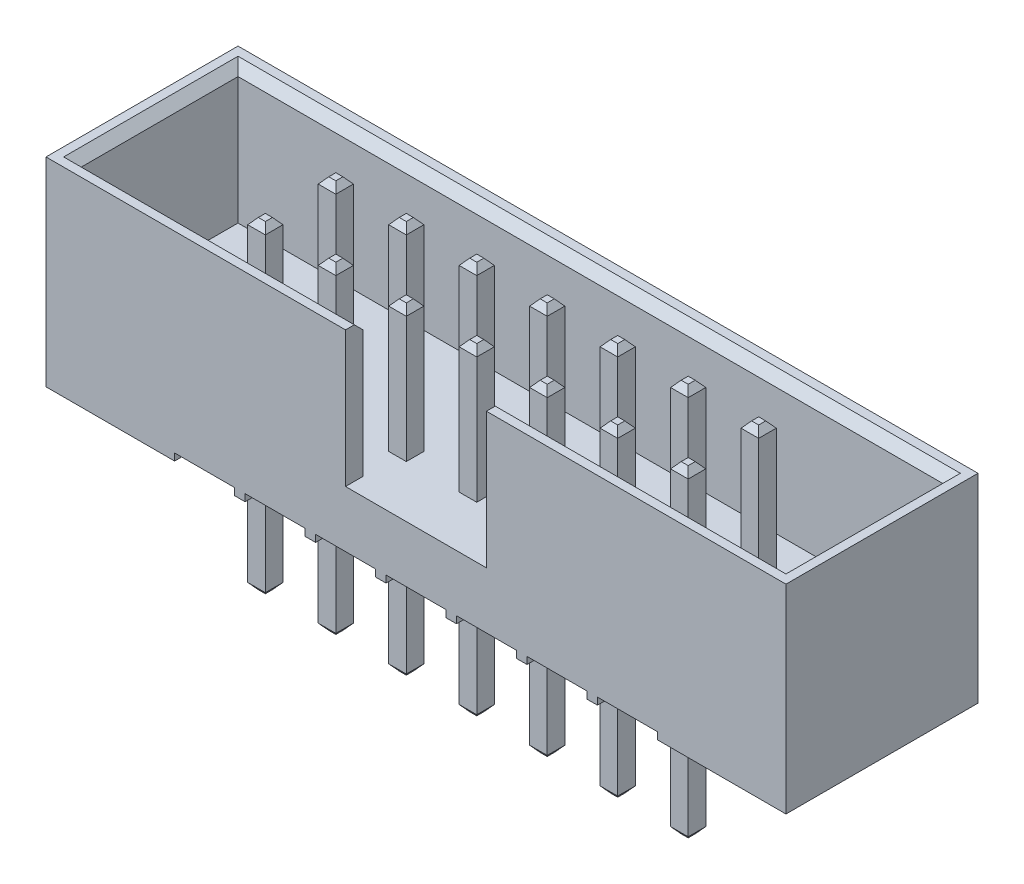
from build123d import *
from OCP.BRepFilletAPI import BRepFilletAPI_MakeChamfer

# Parameters (mm, degrees)
SKETCH_1_W                             = 21
SKETCH_1_H                             = 5.45
EXTRUDE_5083_DEPTH                     = 5.65
SKETCH_6_W                             = 1.7
SKETCH_6_H                             = 0.2
CUT_EXTRUDE_7_DEPTH                    = 23.419299721
PATTERN_LINEAR_3_COUNT                 = 7
PATTERN_LINEAR_3_PITCH                 = 2
SKETCH_2_W                             = 20
SKETCH_2_H                             = 4.45
CUT_EXTRUDE_2_DEPTH                    = 3.85
CUT_EXTRUDE_3_REACH                    = 24.419
SKETCH_3_W                             = 4
SKETCH_3_H                             = 3.85
SKETCH_5_W                             = 0.5
SKETCH_5_H                             = 0.5
EXTRUDE_6751_DEPTH                     = 9.15
CHAMFER_6834_SIZE                      = 0.25
CHAMFER_7155_SIZE                      = 0.15
CHAMFER_7155_SIZE2                     = 0.178763039
PATTERN_LINEAR_2_COUNT                 = 7
PATTERN_LINEAR_2_PITCH                 = 2
CHAMFER_7155_OF_PATTERN_LINEAR_2_SIZE  = 0.15
CHAMFER_7155_OF_PATTERN_LINEAR_2_SIZE2 = 0.178763039


with BuildPart() as part:
    # Эскиз1 → Extrude 5083 (new body)
    with BuildSketch(Plane(origin=(0, 0, 0), x_dir=(1, 0, 0), z_dir=(0, 1, 0))):
        with Locations((10.5, 2.725)):
            Rectangle(SKETCH_1_W, SKETCH_1_H)
    extrude(amount=EXTRUDE_5083_DEPTH)

    # Эскиз6 → Вырез-Вытянуть7 (cut, through all)
    with BuildSketch(Plane.XY):
        with Locations((4.5, 0.1)):
            Rectangle(SKETCH_6_W, SKETCH_6_H)
    cut_extrude_7 = extrude(amount=-CUT_EXTRUDE_7_DEPTH, mode=Mode.SUBTRACT)

    # Линейный массив3: Вырез-Вытянуть7 ×7
    with Locations(*[(i * PATTERN_LINEAR_3_PITCH, 0, 0) for i in range(1, PATTERN_LINEAR_3_COUNT)]):
        add(cut_extrude_7, mode=Mode.SUBTRACT)

    # Эскиз2 → Вырез-Вытянуть2 (cut)
    with BuildSketch(Plane(origin=(0, 5.65, 0), x_dir=(1, 0, 0), z_dir=(0, 1, 0))):
        with Locations((10.5, 2.725)):
            Rectangle(SKETCH_2_W, SKETCH_2_H)
    extrude(amount=-CUT_EXTRUDE_2_DEPTH, mode=Mode.SUBTRACT)

    # Эскиз3 → Вырез-Вытянуть3 (cut, up to next)
    with BuildSketch(Plane.XY, mode=Mode.PRIVATE) as cut_extrude_3_sk1:
        with Locations((10.5, 3.725)):
            Rectangle(SKETCH_3_W, SKETCH_3_H)
    cut_extrude_3_tool1 = extrude(cut_extrude_3_sk1.sketch, amount=-CUT_EXTRUDE_3_REACH, mode=Mode.PRIVATE) & part.part
    add(cut_extrude_3_tool1.solids().sort_by_distance((10.5, 3.725, 0))[0], mode=Mode.SUBTRACT)

    # Эскиз5 → Extrude 6751 (add)
    with BuildSketch(Plane(origin=(0, -3.6, 0), x_dir=(1, 0, 0), z_dir=(0, 1, 0))):
        with Locations((4.5, 1.725)):
            Rectangle(SKETCH_5_W, SKETCH_5_H)
        with Locations((4.5, 3.725)):
            Rectangle(SKETCH_5_W, SKETCH_5_H)
    extrude_6751 = extrude(amount=EXTRUDE_6751_DEPTH)

    # Chamfer 6834
    chamfer_6834_edges = [part.edges().sort_by_distance(p)[0] for p in [
        (0.5, 5.65, -2.725),
        (4.5, 5.65, -0.5),
        (20.5, 5.65, -2.725),
        (10.5, 5.65, -4.95),
        (16.5, 5.65, -0.5),
    ]]
    chamfer(chamfer_6834_edges, length=CHAMFER_6834_SIZE)

    # Chamfer 7155: one chamfer whose edges measure the first distance from different faces: ONE call of the kernel's chamfer builder (chamfer() names one face for all edges)
    chamfer_7155_edges_1 = [part.edges().sort_by_distance(p)[0] for p in [
        (4.5, -3.6, -1.475),
        (4.25, -3.6, -1.725),
        (4.5, -3.6, -1.975),
        (4.75, -3.6, -1.725),
    ]]
    chamfer_7155_side_1 = [part.faces().sort_by_distance(p)[0] for p in [
        (4.5, -3.6, -1.725),
    ]]
    chamfer_7155_edges_2 = [part.edges().sort_by_distance(p)[0] for p in [
        (4.5, 5.55, -1.475),
        (4.25, 5.55, -1.725),
        (4.5, 5.55, -1.975),
        (4.75, 5.55, -1.725),
    ]]
    chamfer_7155_side_2 = [part.faces().sort_by_distance(p)[0] for p in [
        (4.5, 5.55, -1.725),
    ]]
    chamfer_7155_edges_3 = [part.edges().sort_by_distance(p)[0] for p in [
        (4.5, -3.6, -3.475),
        (4.25, -3.6, -3.725),
        (4.5, -3.6, -3.975),
        (4.75, -3.6, -3.725),
    ]]
    chamfer_7155_side_3 = [part.faces().sort_by_distance(p)[0] for p in [
        (4.5, -3.6, -3.725),
    ]]
    chamfer_7155_edges_4 = [part.edges().sort_by_distance(p)[0] for p in [
        (4.5, 5.55, -3.475),
        (4.25, 5.55, -3.725),
        (4.5, 5.55, -3.975),
        (4.75, 5.55, -3.725),
    ]]
    chamfer_7155_side_4 = [part.faces().sort_by_distance(p)[0] for p in [
        (4.5, 5.55, -3.725),
    ]]
    chamfer_7155 = BRepFilletAPI_MakeChamfer(part.part.solid().wrapped)
    for e in chamfer_7155_edges_1:
        chamfer_7155.Add(CHAMFER_7155_SIZE, CHAMFER_7155_SIZE2, e.wrapped, chamfer_7155_side_1[0].wrapped)  # the first distance lies on this face
    for e in chamfer_7155_edges_2:
        chamfer_7155.Add(CHAMFER_7155_SIZE, CHAMFER_7155_SIZE2, e.wrapped, chamfer_7155_side_2[0].wrapped)  # the first distance lies on this face
    for e in chamfer_7155_edges_3:
        chamfer_7155.Add(CHAMFER_7155_SIZE, CHAMFER_7155_SIZE2, e.wrapped, chamfer_7155_side_3[0].wrapped)  # the first distance lies on this face
    for e in chamfer_7155_edges_4:
        chamfer_7155.Add(CHAMFER_7155_SIZE, CHAMFER_7155_SIZE2, e.wrapped, chamfer_7155_side_4[0].wrapped)  # the first distance lies on this face
    add(Compound.cast(chamfer_7155.Shape()), mode=Mode.REPLACE)

    # Линейный массив2: Extrude 6751 ×7
    with Locations(*[(i * PATTERN_LINEAR_2_PITCH, 0, 0) for i in range(1, PATTERN_LINEAR_2_COUNT)]):
        add(extrude_6751)

    # Chamfer 7155 of Линейный массив2: one chamfer whose edges measure the first distance from different faces: ONE call of the kernel's chamfer builder (chamfer() names one face for all edges)
    chamfer_7155_of_pattern_linear_2_edges_1 = [part.edges().sort_by_distance(p)[0] for p in [
        (6.5, -3.6, -1.475),
        (6.25, -3.6, -1.725),
        (6.5, -3.6, -1.975),
        (6.75, -3.6, -1.725),
    ]]
    chamfer_7155_of_pattern_linear_2_side_1 = [part.faces().sort_by_distance(p)[0] for p in [
        (6.5, -3.6, -1.725),
    ]]
    chamfer_7155_of_pattern_linear_2_edges_2 = [part.edges().sort_by_distance(p)[0] for p in [
        (6.5, 5.55, -1.475),
        (6.25, 5.55, -1.725),
        (6.5, 5.55, -1.975),
        (6.75, 5.55, -1.725),
    ]]
    chamfer_7155_of_pattern_linear_2_side_2 = [part.faces().sort_by_distance(p)[0] for p in [
        (6.5, 5.55, -1.725),
    ]]
    chamfer_7155_of_pattern_linear_2_edges_3 = [part.edges().sort_by_distance(p)[0] for p in [
        (6.5, -3.6, -3.475),
        (6.25, -3.6, -3.725),
        (6.5, -3.6, -3.975),
        (6.75, -3.6, -3.725),
    ]]
    chamfer_7155_of_pattern_linear_2_side_3 = [part.faces().sort_by_distance(p)[0] for p in [
        (6.5, -3.6, -3.725),
    ]]
    chamfer_7155_of_pattern_linear_2_edges_4 = [part.edges().sort_by_distance(p)[0] for p in [
        (6.5, 5.55, -3.475),
        (6.25, 5.55, -3.725),
        (6.5, 5.55, -3.975),
        (6.75, 5.55, -3.725),
    ]]
    chamfer_7155_of_pattern_linear_2_side_4 = [part.faces().sort_by_distance(p)[0] for p in [
        (6.5, 5.55, -3.725),
    ]]
    chamfer_7155_of_pattern_linear_2_edges_5 = [part.edges().sort_by_distance(p)[0] for p in [
        (8.5, -3.6, -1.475),
        (8.25, -3.6, -1.725),
        (8.5, -3.6, -1.975),
        (8.75, -3.6, -1.725),
    ]]
    chamfer_7155_of_pattern_linear_2_side_5 = [part.faces().sort_by_distance(p)[0] for p in [
        (8.5, -3.6, -1.725),
    ]]
    chamfer_7155_of_pattern_linear_2_edges_6 = [part.edges().sort_by_distance(p)[0] for p in [
        (8.5, 5.55, -1.475),
        (8.25, 5.55, -1.725),
        (8.5, 5.55, -1.975),
        (8.75, 5.55, -1.725),
    ]]
    chamfer_7155_of_pattern_linear_2_side_6 = [part.faces().sort_by_distance(p)[0] for p in [
        (8.5, 5.55, -1.725),
    ]]
    chamfer_7155_of_pattern_linear_2_edges_7 = [part.edges().sort_by_distance(p)[0] for p in [
        (8.5, -3.6, -3.475),
        (8.25, -3.6, -3.725),
        (8.5, -3.6, -3.975),
        (8.75, -3.6, -3.725),
    ]]
    chamfer_7155_of_pattern_linear_2_side_7 = [part.faces().sort_by_distance(p)[0] for p in [
        (8.5, -3.6, -3.725),
    ]]
    chamfer_7155_of_pattern_linear_2_edges_8 = [part.edges().sort_by_distance(p)[0] for p in [
        (8.5, 5.55, -3.475),
        (8.25, 5.55, -3.725),
        (8.5, 5.55, -3.975),
        (8.75, 5.55, -3.725),
    ]]
    chamfer_7155_of_pattern_linear_2_side_8 = [part.faces().sort_by_distance(p)[0] for p in [
        (8.5, 5.55, -3.725),
    ]]
    chamfer_7155_of_pattern_linear_2_edges_9 = [part.edges().sort_by_distance(p)[0] for p in [
        (10.5, -3.6, -1.475),
        (10.25, -3.6, -1.725),
        (10.5, -3.6, -1.975),
        (10.75, -3.6, -1.725),
    ]]
    chamfer_7155_of_pattern_linear_2_side_9 = [part.faces().sort_by_distance(p)[0] for p in [
        (10.5, -3.6, -1.725),
    ]]
    chamfer_7155_of_pattern_linear_2_edges_10 = [part.edges().sort_by_distance(p)[0] for p in [
        (10.5, 5.55, -1.475),
        (10.25, 5.55, -1.725),
        (10.5, 5.55, -1.975),
        (10.75, 5.55, -1.725),
    ]]
    chamfer_7155_of_pattern_linear_2_side_10 = [part.faces().sort_by_distance(p)[0] for p in [
        (10.5, 5.55, -1.725),
    ]]
    chamfer_7155_of_pattern_linear_2_edges_11 = [part.edges().sort_by_distance(p)[0] for p in [
        (10.5, -3.6, -3.475),
        (10.25, -3.6, -3.725),
        (10.5, -3.6, -3.975),
        (10.75, -3.6, -3.725),
    ]]
    chamfer_7155_of_pattern_linear_2_side_11 = [part.faces().sort_by_distance(p)[0] for p in [
        (10.5, -3.6, -3.725),
    ]]
    chamfer_7155_of_pattern_linear_2_edges_12 = [part.edges().sort_by_distance(p)[0] for p in [
        (10.5, 5.55, -3.475),
        (10.25, 5.55, -3.725),
        (10.5, 5.55, -3.975),
        (10.75, 5.55, -3.725),
    ]]
    chamfer_7155_of_pattern_linear_2_side_12 = [part.faces().sort_by_distance(p)[0] for p in [
        (10.5, 5.55, -3.725),
    ]]
    chamfer_7155_of_pattern_linear_2_edges_13 = [part.edges().sort_by_distance(p)[0] for p in [
        (12.5, -3.6, -1.475),
        (12.25, -3.6, -1.725),
        (12.5, -3.6, -1.975),
        (12.75, -3.6, -1.725),
    ]]
    chamfer_7155_of_pattern_linear_2_side_13 = [part.faces().sort_by_distance(p)[0] for p in [
        (12.5, -3.6, -1.725),
    ]]
    chamfer_7155_of_pattern_linear_2_edges_14 = [part.edges().sort_by_distance(p)[0] for p in [
        (12.5, 5.55, -1.475),
        (12.25, 5.55, -1.725),
        (12.5, 5.55, -1.975),
        (12.75, 5.55, -1.725),
    ]]
    chamfer_7155_of_pattern_linear_2_side_14 = [part.faces().sort_by_distance(p)[0] for p in [
        (12.5, 5.55, -1.725),
    ]]
    chamfer_7155_of_pattern_linear_2_edges_15 = [part.edges().sort_by_distance(p)[0] for p in [
        (12.5, -3.6, -3.475),
        (12.25, -3.6, -3.725),
        (12.5, -3.6, -3.975),
        (12.75, -3.6, -3.725),
    ]]
    chamfer_7155_of_pattern_linear_2_side_15 = [part.faces().sort_by_distance(p)[0] for p in [
        (12.5, -3.6, -3.725),
    ]]
    chamfer_7155_of_pattern_linear_2_edges_16 = [part.edges().sort_by_distance(p)[0] for p in [
        (12.5, 5.55, -3.475),
        (12.25, 5.55, -3.725),
        (12.5, 5.55, -3.975),
        (12.75, 5.55, -3.725),
    ]]
    chamfer_7155_of_pattern_linear_2_side_16 = [part.faces().sort_by_distance(p)[0] for p in [
        (12.5, 5.55, -3.725),
    ]]
    chamfer_7155_of_pattern_linear_2_edges_17 = [part.edges().sort_by_distance(p)[0] for p in [
        (14.5, -3.6, -1.475),
        (14.25, -3.6, -1.725),
        (14.5, -3.6, -1.975),
        (14.75, -3.6, -1.725),
    ]]
    chamfer_7155_of_pattern_linear_2_side_17 = [part.faces().sort_by_distance(p)[0] for p in [
        (14.5, -3.6, -1.725),
    ]]
    chamfer_7155_of_pattern_linear_2_edges_18 = [part.edges().sort_by_distance(p)[0] for p in [
        (14.5, 5.55, -1.475),
        (14.25, 5.55, -1.725),
        (14.5, 5.55, -1.975),
        (14.75, 5.55, -1.725),
    ]]
    chamfer_7155_of_pattern_linear_2_side_18 = [part.faces().sort_by_distance(p)[0] for p in [
        (14.5, 5.55, -1.725),
    ]]
    chamfer_7155_of_pattern_linear_2_edges_19 = [part.edges().sort_by_distance(p)[0] for p in [
        (14.5, -3.6, -3.475),
        (14.25, -3.6, -3.725),
        (14.5, -3.6, -3.975),
        (14.75, -3.6, -3.725),
    ]]
    chamfer_7155_of_pattern_linear_2_side_19 = [part.faces().sort_by_distance(p)[0] for p in [
        (14.5, -3.6, -3.725),
    ]]
    chamfer_7155_of_pattern_linear_2_edges_20 = [part.edges().sort_by_distance(p)[0] for p in [
        (14.5, 5.55, -3.475),
        (14.25, 5.55, -3.725),
        (14.5, 5.55, -3.975),
        (14.75, 5.55, -3.725),
    ]]
    chamfer_7155_of_pattern_linear_2_side_20 = [part.faces().sort_by_distance(p)[0] for p in [
        (14.5, 5.55, -3.725),
    ]]
    chamfer_7155_of_pattern_linear_2_edges_21 = [part.edges().sort_by_distance(p)[0] for p in [
        (16.5, -3.6, -1.475),
        (16.25, -3.6, -1.725),
        (16.5, -3.6, -1.975),
        (16.75, -3.6, -1.725),
    ]]
    chamfer_7155_of_pattern_linear_2_side_21 = [part.faces().sort_by_distance(p)[0] for p in [
        (16.5, -3.6, -1.725),
    ]]
    chamfer_7155_of_pattern_linear_2_edges_22 = [part.edges().sort_by_distance(p)[0] for p in [
        (16.5, 5.55, -1.475),
        (16.25, 5.55, -1.725),
        (16.5, 5.55, -1.975),
        (16.75, 5.55, -1.725),
    ]]
    chamfer_7155_of_pattern_linear_2_side_22 = [part.faces().sort_by_distance(p)[0] for p in [
        (16.5, 5.55, -1.725),
    ]]
    chamfer_7155_of_pattern_linear_2_edges_23 = [part.edges().sort_by_distance(p)[0] for p in [
        (16.5, -3.6, -3.475),
        (16.25, -3.6, -3.725),
        (16.5, -3.6, -3.975),
        (16.75, -3.6, -3.725),
    ]]
    chamfer_7155_of_pattern_linear_2_side_23 = [part.faces().sort_by_distance(p)[0] for p in [
        (16.5, -3.6, -3.725),
    ]]
    chamfer_7155_of_pattern_linear_2_edges_24 = [part.edges().sort_by_distance(p)[0] for p in [
        (16.5, 5.55, -3.475),
        (16.25, 5.55, -3.725),
        (16.5, 5.55, -3.975),
        (16.75, 5.55, -3.725),
    ]]
    chamfer_7155_of_pattern_linear_2_side_24 = [part.faces().sort_by_distance(p)[0] for p in [
        (16.5, 5.55, -3.725),
    ]]
    chamfer_7155_of_pattern_linear_2 = BRepFilletAPI_MakeChamfer(part.part.solid().wrapped)
    for e in chamfer_7155_of_pattern_linear_2_edges_1:
        chamfer_7155_of_pattern_linear_2.Add(CHAMFER_7155_OF_PATTERN_LINEAR_2_SIZE, CHAMFER_7155_OF_PATTERN_LINEAR_2_SIZE2, e.wrapped, chamfer_7155_of_pattern_linear_2_side_1[0].wrapped)  # the first distance lies on this face
    for e in chamfer_7155_of_pattern_linear_2_edges_2:
        chamfer_7155_of_pattern_linear_2.Add(CHAMFER_7155_OF_PATTERN_LINEAR_2_SIZE, CHAMFER_7155_OF_PATTERN_LINEAR_2_SIZE2, e.wrapped, chamfer_7155_of_pattern_linear_2_side_2[0].wrapped)  # the first distance lies on this face
    for e in chamfer_7155_of_pattern_linear_2_edges_3:
        chamfer_7155_of_pattern_linear_2.Add(CHAMFER_7155_OF_PATTERN_LINEAR_2_SIZE, CHAMFER_7155_OF_PATTERN_LINEAR_2_SIZE2, e.wrapped, chamfer_7155_of_pattern_linear_2_side_3[0].wrapped)  # the first distance lies on this face
    for e in chamfer_7155_of_pattern_linear_2_edges_4:
        chamfer_7155_of_pattern_linear_2.Add(CHAMFER_7155_OF_PATTERN_LINEAR_2_SIZE, CHAMFER_7155_OF_PATTERN_LINEAR_2_SIZE2, e.wrapped, chamfer_7155_of_pattern_linear_2_side_4[0].wrapped)  # the first distance lies on this face
    for e in chamfer_7155_of_pattern_linear_2_edges_5:
        chamfer_7155_of_pattern_linear_2.Add(CHAMFER_7155_OF_PATTERN_LINEAR_2_SIZE, CHAMFER_7155_OF_PATTERN_LINEAR_2_SIZE2, e.wrapped, chamfer_7155_of_pattern_linear_2_side_5[0].wrapped)  # the first distance lies on this face
    for e in chamfer_7155_of_pattern_linear_2_edges_6:
        chamfer_7155_of_pattern_linear_2.Add(CHAMFER_7155_OF_PATTERN_LINEAR_2_SIZE, CHAMFER_7155_OF_PATTERN_LINEAR_2_SIZE2, e.wrapped, chamfer_7155_of_pattern_linear_2_side_6[0].wrapped)  # the first distance lies on this face
    for e in chamfer_7155_of_pattern_linear_2_edges_7:
        chamfer_7155_of_pattern_linear_2.Add(CHAMFER_7155_OF_PATTERN_LINEAR_2_SIZE, CHAMFER_7155_OF_PATTERN_LINEAR_2_SIZE2, e.wrapped, chamfer_7155_of_pattern_linear_2_side_7[0].wrapped)  # the first distance lies on this face
    for e in chamfer_7155_of_pattern_linear_2_edges_8:
        chamfer_7155_of_pattern_linear_2.Add(CHAMFER_7155_OF_PATTERN_LINEAR_2_SIZE, CHAMFER_7155_OF_PATTERN_LINEAR_2_SIZE2, e.wrapped, chamfer_7155_of_pattern_linear_2_side_8[0].wrapped)  # the first distance lies on this face
    for e in chamfer_7155_of_pattern_linear_2_edges_9:
        chamfer_7155_of_pattern_linear_2.Add(CHAMFER_7155_OF_PATTERN_LINEAR_2_SIZE, CHAMFER_7155_OF_PATTERN_LINEAR_2_SIZE2, e.wrapped, chamfer_7155_of_pattern_linear_2_side_9[0].wrapped)  # the first distance lies on this face
    for e in chamfer_7155_of_pattern_linear_2_edges_10:
        chamfer_7155_of_pattern_linear_2.Add(CHAMFER_7155_OF_PATTERN_LINEAR_2_SIZE, CHAMFER_7155_OF_PATTERN_LINEAR_2_SIZE2, e.wrapped, chamfer_7155_of_pattern_linear_2_side_10[0].wrapped)  # the first distance lies on this face
    for e in chamfer_7155_of_pattern_linear_2_edges_11:
        chamfer_7155_of_pattern_linear_2.Add(CHAMFER_7155_OF_PATTERN_LINEAR_2_SIZE, CHAMFER_7155_OF_PATTERN_LINEAR_2_SIZE2, e.wrapped, chamfer_7155_of_pattern_linear_2_side_11[0].wrapped)  # the first distance lies on this face
    for e in chamfer_7155_of_pattern_linear_2_edges_12:
        chamfer_7155_of_pattern_linear_2.Add(CHAMFER_7155_OF_PATTERN_LINEAR_2_SIZE, CHAMFER_7155_OF_PATTERN_LINEAR_2_SIZE2, e.wrapped, chamfer_7155_of_pattern_linear_2_side_12[0].wrapped)  # the first distance lies on this face
    for e in chamfer_7155_of_pattern_linear_2_edges_13:
        chamfer_7155_of_pattern_linear_2.Add(CHAMFER_7155_OF_PATTERN_LINEAR_2_SIZE, CHAMFER_7155_OF_PATTERN_LINEAR_2_SIZE2, e.wrapped, chamfer_7155_of_pattern_linear_2_side_13[0].wrapped)  # the first distance lies on this face
    for e in chamfer_7155_of_pattern_linear_2_edges_14:
        chamfer_7155_of_pattern_linear_2.Add(CHAMFER_7155_OF_PATTERN_LINEAR_2_SIZE, CHAMFER_7155_OF_PATTERN_LINEAR_2_SIZE2, e.wrapped, chamfer_7155_of_pattern_linear_2_side_14[0].wrapped)  # the first distance lies on this face
    for e in chamfer_7155_of_pattern_linear_2_edges_15:
        chamfer_7155_of_pattern_linear_2.Add(CHAMFER_7155_OF_PATTERN_LINEAR_2_SIZE, CHAMFER_7155_OF_PATTERN_LINEAR_2_SIZE2, e.wrapped, chamfer_7155_of_pattern_linear_2_side_15[0].wrapped)  # the first distance lies on this face
    for e in chamfer_7155_of_pattern_linear_2_edges_16:
        chamfer_7155_of_pattern_linear_2.Add(CHAMFER_7155_OF_PATTERN_LINEAR_2_SIZE, CHAMFER_7155_OF_PATTERN_LINEAR_2_SIZE2, e.wrapped, chamfer_7155_of_pattern_linear_2_side_16[0].wrapped)  # the first distance lies on this face
    for e in chamfer_7155_of_pattern_linear_2_edges_17:
        chamfer_7155_of_pattern_linear_2.Add(CHAMFER_7155_OF_PATTERN_LINEAR_2_SIZE, CHAMFER_7155_OF_PATTERN_LINEAR_2_SIZE2, e.wrapped, chamfer_7155_of_pattern_linear_2_side_17[0].wrapped)  # the first distance lies on this face
    for e in chamfer_7155_of_pattern_linear_2_edges_18:
        chamfer_7155_of_pattern_linear_2.Add(CHAMFER_7155_OF_PATTERN_LINEAR_2_SIZE, CHAMFER_7155_OF_PATTERN_LINEAR_2_SIZE2, e.wrapped, chamfer_7155_of_pattern_linear_2_side_18[0].wrapped)  # the first distance lies on this face
    for e in chamfer_7155_of_pattern_linear_2_edges_19:
        chamfer_7155_of_pattern_linear_2.Add(CHAMFER_7155_OF_PATTERN_LINEAR_2_SIZE, CHAMFER_7155_OF_PATTERN_LINEAR_2_SIZE2, e.wrapped, chamfer_7155_of_pattern_linear_2_side_19[0].wrapped)  # the first distance lies on this face
    for e in chamfer_7155_of_pattern_linear_2_edges_20:
        chamfer_7155_of_pattern_linear_2.Add(CHAMFER_7155_OF_PATTERN_LINEAR_2_SIZE, CHAMFER_7155_OF_PATTERN_LINEAR_2_SIZE2, e.wrapped, chamfer_7155_of_pattern_linear_2_side_20[0].wrapped)  # the first distance lies on this face
    for e in chamfer_7155_of_pattern_linear_2_edges_21:
        chamfer_7155_of_pattern_linear_2.Add(CHAMFER_7155_OF_PATTERN_LINEAR_2_SIZE, CHAMFER_7155_OF_PATTERN_LINEAR_2_SIZE2, e.wrapped, chamfer_7155_of_pattern_linear_2_side_21[0].wrapped)  # the first distance lies on this face
    for e in chamfer_7155_of_pattern_linear_2_edges_22:
        chamfer_7155_of_pattern_linear_2.Add(CHAMFER_7155_OF_PATTERN_LINEAR_2_SIZE, CHAMFER_7155_OF_PATTERN_LINEAR_2_SIZE2, e.wrapped, chamfer_7155_of_pattern_linear_2_side_22[0].wrapped)  # the first distance lies on this face
    for e in chamfer_7155_of_pattern_linear_2_edges_23:
        chamfer_7155_of_pattern_linear_2.Add(CHAMFER_7155_OF_PATTERN_LINEAR_2_SIZE, CHAMFER_7155_OF_PATTERN_LINEAR_2_SIZE2, e.wrapped, chamfer_7155_of_pattern_linear_2_side_23[0].wrapped)  # the first distance lies on this face
    for e in chamfer_7155_of_pattern_linear_2_edges_24:
        chamfer_7155_of_pattern_linear_2.Add(CHAMFER_7155_OF_PATTERN_LINEAR_2_SIZE, CHAMFER_7155_OF_PATTERN_LINEAR_2_SIZE2, e.wrapped, chamfer_7155_of_pattern_linear_2_side_24[0].wrapped)  # the first distance lies on this face
    add(Compound.cast(chamfer_7155_of_pattern_linear_2.Shape()), mode=Mode.REPLACE)


solid = part.part
